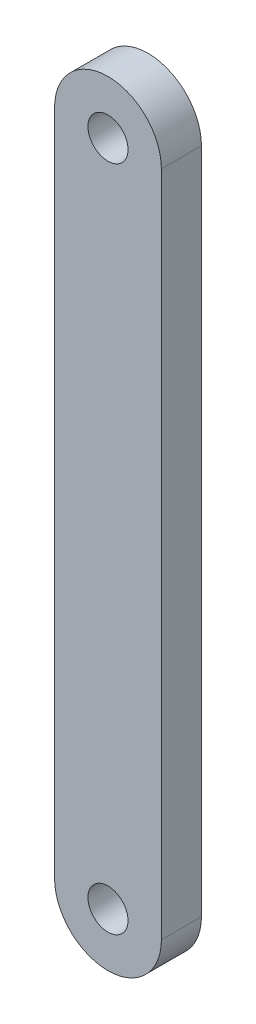
from build123d import *

# Parameters (mm, degrees)
CROQUIS1_R              = 1.5
SALIENTE_EXTRUIR1_DEPTH = 3


with BuildPart() as part:
    # Croquis1 → Saliente-Extruir1 (new body)
    with BuildSketch(Plane.XY):
        with BuildLine():
            Line((4, 25), (4, -25))
            ThreePointArc((4, -25), (0, -29), (-4, -25))
            Line((-4, -25), (-4, 25))
            ThreePointArc((-4, 25), (0, 29), (4, 25))
        make_face()
        with Locations((0, -25)):
            Circle(CROQUIS1_R, mode=Mode.SUBTRACT)
        with Locations((0, 25)):
            Circle(CROQUIS1_R, mode=Mode.SUBTRACT)
    extrude(amount=SALIENTE_EXTRUIR1_DEPTH)


solid = part.part
